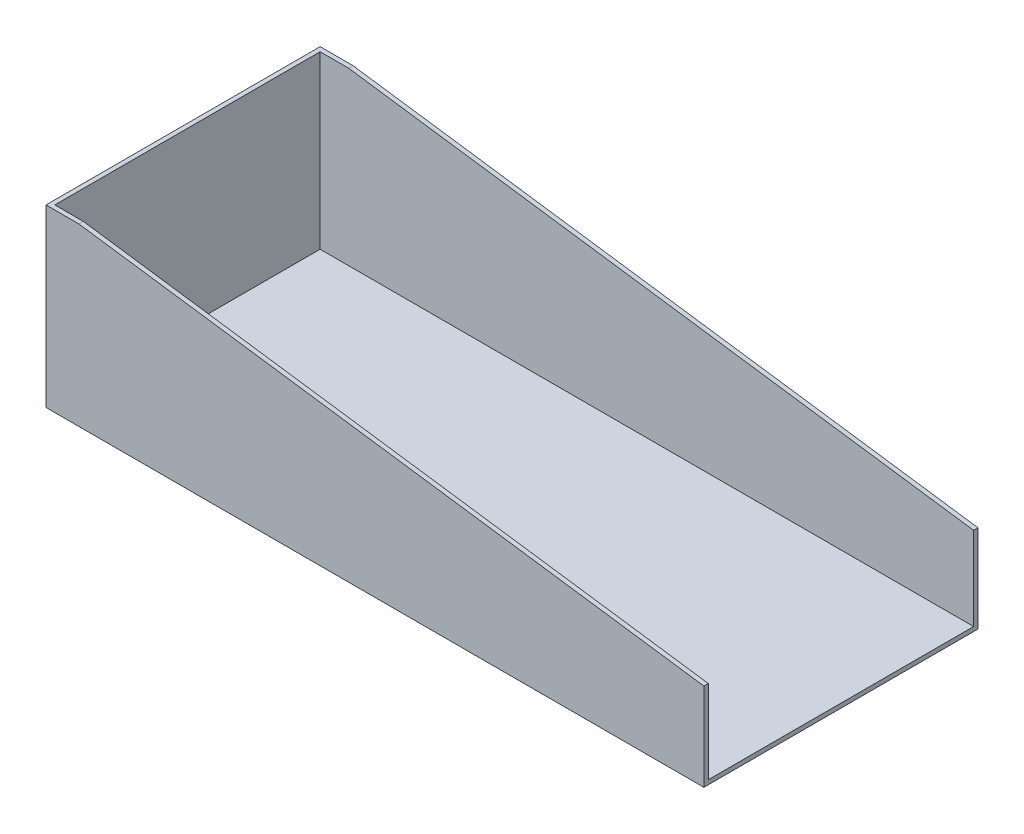
from build123d import *

# Parameters (mm, degrees)
SKETCH1_W           = 300
SKETCH1_H           = 125
BOSS_EXTRUDE2_DEPTH = 80
CUT_EXTRUDE2_DEPTH  = 135
SHELL2_T            = -2


with BuildPart() as part:
    # Sketch1 → Boss-Extrude2 (new body)
    with BuildSketch(Plane(origin=(0, 0, 0), x_dir=(1, 0, 0), z_dir=(0, 1, 0))):
        with Locations((-150, 62.5)):
            Rectangle(SKETCH1_W, SKETCH1_H)
    extrude(amount=BOSS_EXTRUDE2_DEPTH)

    # Sketch3 → Cut-Extrude2 (cut)
    with BuildSketch(Plane.XY):
        Polygon((0, 80), (-285, 80), (0, 40), align=None)
    extrude(amount=-CUT_EXTRUDE2_DEPTH, mode=Mode.SUBTRACT)

    # Shell2
    shell2_openings = [part.faces().sort_by_distance(p)[0] for p in [
        (-292.5, 80, -62.5),
        (-142.5, 60, -62.5),
        (0, 20, -62.5),
    ]]
    offset(amount=SHELL2_T, openings=shell2_openings, kind=Kind.INTERSECTION)


solid = part.part
